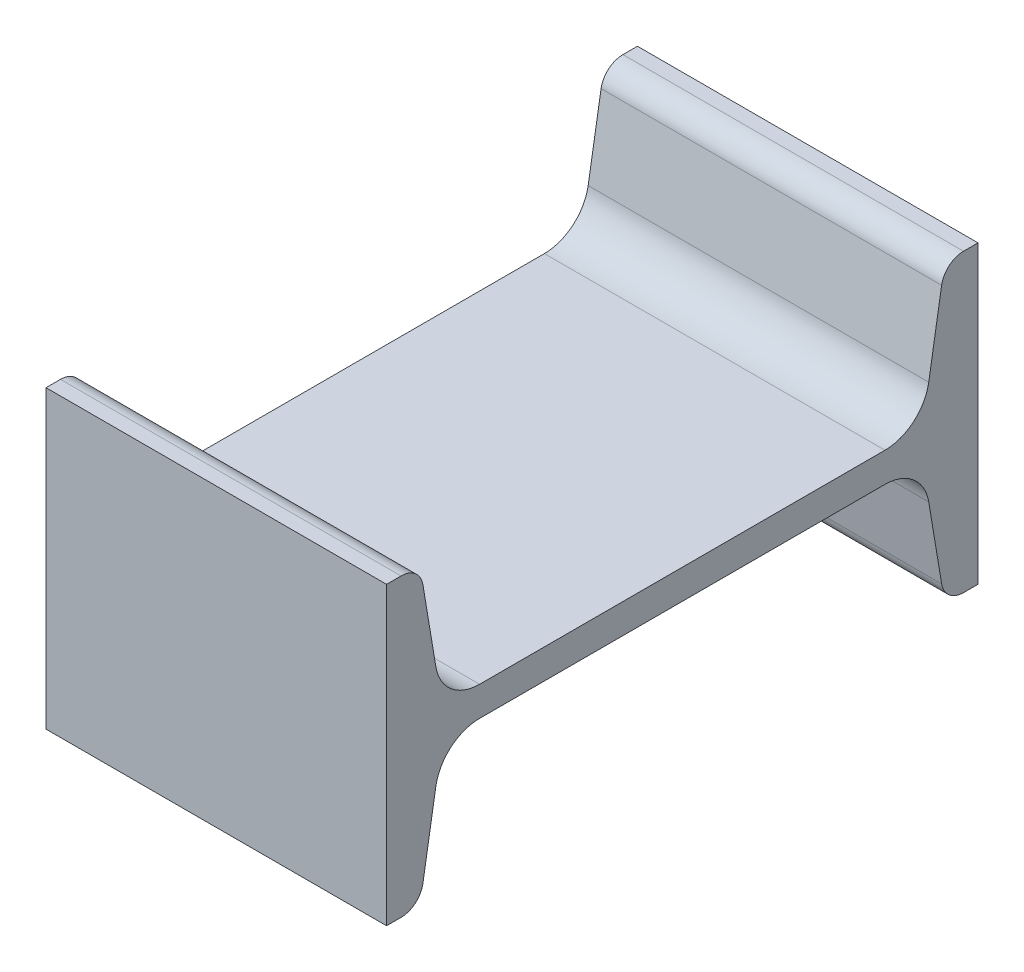
from build123d import *

# Parameters (mm, degrees)
SB_KIRI_80_X_6_1_DEPTH = 46.068610974


with BuildPart() as part:
    # Sketch14 → Sb kiriş 80 X 6(1) (new body)
    with BuildSketch(Plane.YZ):
        with BuildLine():
            Line((-20, -40), (-20, -38.04146021))
            ThreePointArc((-20, -38.04146021), (-19.289071417, -36.102349061), (-17.493231968, -35.082284273))
            Line((-17.493231968, -35.082284273), (-7.013536064, -33.335540874))
            ThreePointArc((-7.013536064, -33.335540874), (-3.421857166, -31.295411298), (-2, -27.417189))
            Line((-2, -27.417189), (-2, 27.417189))
            ThreePointArc((-2, 27.417189), (-3.421857166, 31.295411298), (-7.013536064, 33.335540874))
            Line((-7.013536064, 33.335540874), (-17.493231968, 35.082284273))
            ThreePointArc((-17.493231968, 35.082284273), (-19.289071417, 36.102349061), (-20, 38.04146021))
            Line((-20, 38.04146021), (-20, 40))
            Line((-20, 40), (20, 40))
            Line((20, 40), (20, 38.04146021))
            ThreePointArc((20, 38.04146021), (19.289071417, 36.102349061), (17.493231968, 35.082284273))
            Line((17.493231968, 35.082284273), (7.013536064, 33.335540874))
            ThreePointArc((7.013536064, 33.335540874), (3.421857166, 31.295411298), (2, 27.417189))
            Line((2, 27.417189), (2, -27.417189))
            ThreePointArc((2, -27.417189), (3.421857166, -31.295411298), (7.013536064, -33.335540874))
            Line((7.013536064, -33.335540874), (17.493231968, -35.082284273))
            ThreePointArc((17.493231968, -35.082284273), (19.289071417, -36.102349061), (20, -38.04146021))
            Line((20, -38.04146021), (20, -40))
            Line((20, -40), (-20, -40))
        make_face()
    extrude(amount=SB_KIRI_80_X_6_1_DEPTH)


solid = part.part
